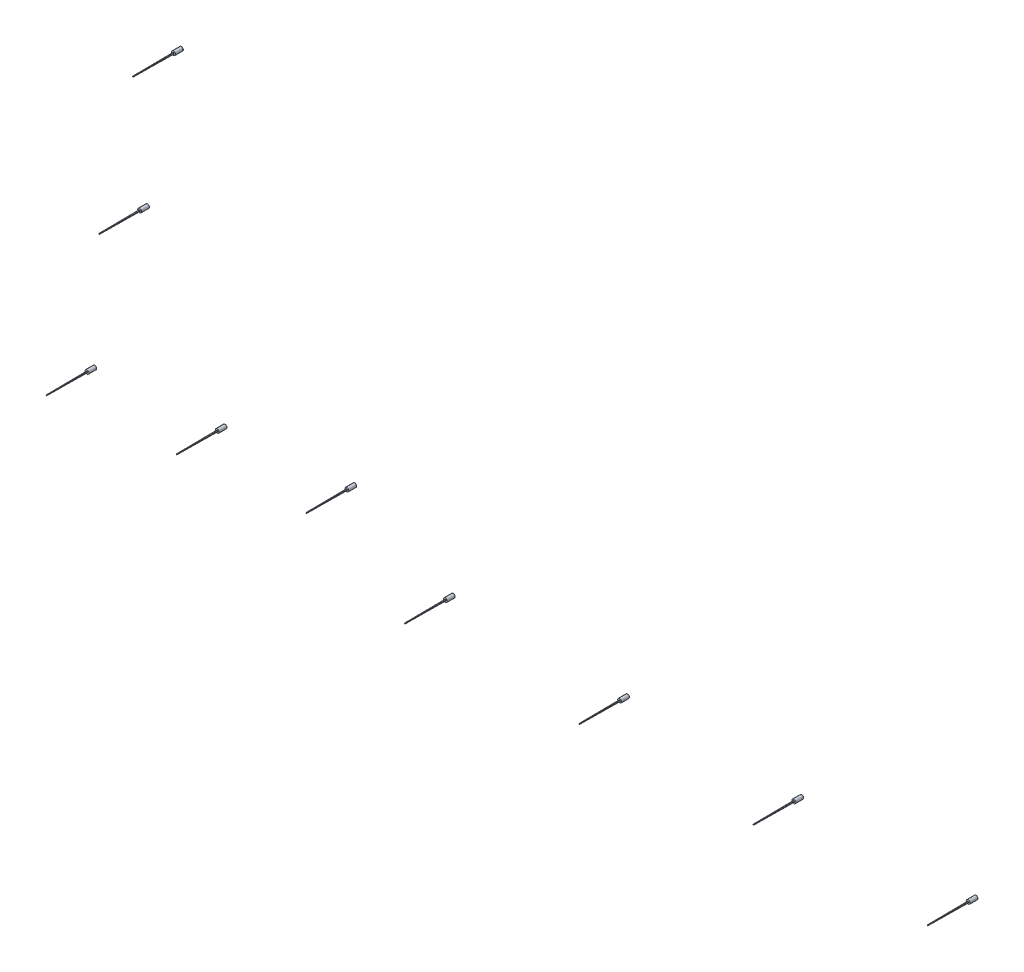
from build123d import *

# Parameters (mm, degrees)
SALIENTE_EXTRUIR1_DEPTH           = 11000
SALIENTE_EXTRUIR1_DRAFT           = 0.39
SALIENTE_EXTRUIR1_PROFILE_2_DEPTH = 11000
SALIENTE_EXTRUIR1_PROFILE_2_DRAFT = 0.39
SALIENTE_EXTRUIR1_PROFILE_3_DEPTH = 11000
SALIENTE_EXTRUIR1_PROFILE_3_DRAFT = 0.39
SALIENTE_EXTRUIR1_PROFILE_4_DEPTH = 11000
SALIENTE_EXTRUIR1_PROFILE_4_DRAFT = 0.39
SALIENTE_EXTRUIR1_PROFILE_5_DEPTH = 11000
SALIENTE_EXTRUIR1_PROFILE_5_DRAFT = 0.39
SALIENTE_EXTRUIR1_PROFILE_6_DEPTH = 11000
SALIENTE_EXTRUIR1_PROFILE_6_DRAFT = 0.39
SALIENTE_EXTRUIR1_PROFILE_7_DEPTH = 11000
SALIENTE_EXTRUIR1_PROFILE_7_DRAFT = 0.39
SALIENTE_EXTRUIR1_PROFILE_8_DEPTH = 11000
SALIENTE_EXTRUIR1_PROFILE_8_DRAFT = 0.39
SALIENTE_EXTRUIR1_PROFILE_9_DEPTH = 11000
SALIENTE_EXTRUIR1_PROFILE_9_DRAFT = 0.39
CROQUIS9_R                        = 450
SALIENTE_EXTRUIR8_DEPTH           = 1700
CROQUIS10_R                       = 455
SALIENTE_EXTRUIR9_DEPTH           = 100
CROQUIS11_R                       = 574.012374022
CORTAR_EXTRUIR1_DEPTH             = 3000
CROQUIS12_R                       = 450
SALIENTE_EXTRUIR10_DEPTH          = 1700
CROQUIS13_R                       = 455
SALIENTE_EXTRUIR11_DEPTH          = 100


with BuildPart() as part:
    # Croquis1 → Saliente-Extruir1 (with draft: the straight prism first)
    with BuildSketch(Plane.XY):
        Polygon((88.617038428, 158.814421575), (-93.228804357, 156.151817274), (-181.845842785, -2.662604301), (-88.617038428, -158.814421575), (93.228804357, -156.151817274), (181.845842785, 2.662604301), align=None)
    extrude(amount=SALIENTE_EXTRUIR1_DEPTH)
    # Saliente-Extruir1: the draft: its side faces are tilted about the plane it starts from
    saliente_extruir1_sides = [part.faces().sort_by_distance(p)[0] for p in [
        (-2.305882965, 157.483119425, 5500),
        (-137.537323571, 76.744606487, 5500),
        (-135.231440607, -80.738512938, 5500),
        (2.305882965, -157.483119425, 5500),
        (137.537323571, -76.744606487, 5500),
        (135.231440607, 80.738512938, 5500),
    ]]
    draft(saliente_extruir1_sides, Plane.XY, SALIENTE_EXTRUIR1_DRAFT)



with BuildPart() as body_2:
    # Croquis1 → Saliente-Extruir1 profile 2 (with draft: the straight prism first)
    with BuildSketch(Plane.XY):
        Polygon((-39933.423158214, 169.241023803), (-40113.278605083, 142.277748192), (-40179.855446869, -26.963275611), (-40066.576841786, -169.241023803), (-39886.721394917, -142.277748192), (-39820.144553131, 26.963275611), align=None)
    extrude(amount=SALIENTE_EXTRUIR1_PROFILE_2_DEPTH)
    # Saliente-Extruir1 profile 2: the draft: its side faces are tilted about the plane it starts from
    saliente_extruir1_profile_2_sides = [body_2.faces().sort_by_distance(p)[0] for p in [
        (-40023.350881648, 155.759385997, 5500),
        (-40146.567025976, 57.65723629, 5500),
        (-40123.216144327, -98.102149707, 5500),
        (-39976.649118352, -155.759385997, 5500),
        (-39853.432974024, -57.65723629, 5500),
        (-39876.783855673, 98.102149707, 5500),
    ]]
    draft(saliente_extruir1_profile_2_sides, Plane.XY, SALIENTE_EXTRUIR1_PROFILE_2_DRAFT)


with BuildPart() as body_3:
    # Croquis1 → Saliente-Extruir1 profile 3 (with draft: the straight prism first)
    with BuildSketch(Plane.XY):
        Polygon((-182312.764922916, 77664.490519876), (-182494.580854337, 77660.251760415), (-182581.817946673, 77500.675165262), (-182487.239107589, 77345.337329569), (-182305.423176169, 77349.576089031), (-182218.186083832, 77509.152684184), align=None)
    extrude(amount=SALIENTE_EXTRUIR1_PROFILE_3_DEPTH)
    # Saliente-Extruir1 profile 3: the draft: its side faces are tilted about the plane it starts from
    saliente_extruir1_profile_3_sides = [body_3.faces().sort_by_distance(p)[0] for p in [
        (-182403.672888627, 77662.371140145, 5500),
        (-182538.199400505, 77580.463462838, 5500),
        (-182534.528527131, 77423.006247416, 5500),
        (-182396.331141879, 77347.4567093, 5500),
        (-182261.80463, 77429.364386607, 5500),
        (-182265.475503374, 77586.82160203, 5500),
    ]]
    draft(saliente_extruir1_profile_3_sides, Plane.XY, SALIENTE_EXTRUIR1_PROFILE_3_DRAFT)

    # Croquis12 → Saliente-Extruir10 (add)
    with BuildSketch(Plane(origin=(0, 0, 0), x_dir=(-1, 0, 0), z_dir=(0, 0, -1))):
        with Locations((182403.672888627, 77506.920712242)):
            Circle(CROQUIS12_R)
    extrude(amount=-SALIENTE_EXTRUIR10_DEPTH)

    # Croquis13 → Saliente-Extruir11 (add)
    with BuildSketch(Plane(origin=(0, 0, 0), x_dir=(-1, 0, 0), z_dir=(0, 0, -1))):
        with Locations((182403.672888627, 77506.920712242)):
            Circle(CROQUIS13_R)
    extrude(amount=SALIENTE_EXTRUIR11_DEPTH)


with BuildPart() as body_4:
    # Croquis1 → Saliente-Extruir1 profile 4 (with draft: the straight prism first)
    with BuildSketch(Plane.XY):
        Polygon((-79908.3116981, 157.061310623), (-80090.174934002, 157.935053987), (-80181.863235901, 0.873743363), (-80091.6883019, -157.061310623), (-79909.825065998, -157.935053987), (-79818.136764099, -0.873743363), align=None)
    extrude(amount=SALIENTE_EXTRUIR1_PROFILE_4_DEPTH)
    # Saliente-Extruir1 profile 4: the draft: its side faces are tilted about the plane it starts from
    saliente_extruir1_profile_4_sides = [body_4.faces().sort_by_distance(p)[0] for p in [
        (-79999.243316051, 157.498182305, 5500),
        (-80136.019084952, 79.404398675, 5500),
        (-80136.775768901, -78.09378363, 5500),
        (-80000.756683949, -157.498182305, 5500),
        (-79863.980915048, -79.404398675, 5500),
        (-79863.224231099, 78.09378363, 5500),
    ]]
    draft(saliente_extruir1_profile_4_sides, Plane.XY, SALIENTE_EXTRUIR1_PROFILE_4_DRAFT)


with BuildPart() as body_5:
    # Croquis1 → Saliente-Extruir1 profile 5 (with draft: the straight prism first)
    with BuildSketch(Plane.XY):
        Polygon((-119896.172838657, 149.314837064), (-120077.396861388, 164.574377857), (-120181.224022731, 15.259540793), (-120103.827161343, -149.314837064), (-119922.603138612, -164.574377858), (-119818.775977269, -15.259540793), align=None)
    extrude(amount=SALIENTE_EXTRUIR1_PROFILE_5_DEPTH)
    # Saliente-Extruir1 profile 5: the draft: its side faces are tilted about the plane it starts from
    saliente_extruir1_profile_5_sides = [body_5.faces().sort_by_distance(p)[0] for p in [
        (-119986.784850023, 156.944607461, 5500),
        (-120129.31044206, 89.916959325, 5500),
        (-120142.525592037, -67.027648136, 5500),
        (-120013.215149977, -156.944607461, 5500),
        (-119870.68955794, -89.916959325, 5500),
        (-119857.474407963, 67.027648135, 5500),
    ]]
    draft(saliente_extruir1_profile_5_sides, Plane.XY, SALIENTE_EXTRUIR1_PROFILE_5_DRAFT)


with BuildPart() as body_6:
    # Croquis1 → Saliente-Extruir1 profile 6 (with draft: the straight prism first)
    with BuildSketch(Plane.XY):
        Polygon((-142531.584159759, 10809.920223672), (-142713.38191326, 10804.962722093), (-142799.987467705, 10645.042498421), (-142704.795268648, 10490.079776328), (-142522.997515147, 10495.037277906), (-142436.391960702, 10654.957501579), align=None)
    extrude(amount=SALIENTE_EXTRUIR1_PROFILE_6_DEPTH)
    # Saliente-Extruir1 profile 6: the draft: its side faces are tilted about the plane it starts from
    saliente_extruir1_profile_6_sides = [body_6.faces().sort_by_distance(p)[0] for p in [
        (-142622.48303651, 10807.441472883, 5500),
        (-142756.684690483, 10725.002610257, 5500),
        (-142752.391368176, 10567.561137374, 5500),
        (-142613.896391897, 10492.558527117, 5500),
        (-142479.694737925, 10574.997389742, 5500),
        (-142483.988060231, 10732.438862625, 5500),
    ]]
    draft(saliente_extruir1_profile_6_sides, Plane.XY, SALIENTE_EXTRUIR1_PROFILE_6_DRAFT)


with BuildPart() as body_7:
    # Croquis1 → Saliente-Extruir1 profile 7 (with draft: the straight prism first)
    with BuildSketch(Plane.XY):
        Polygon((-190012.71485084, 42422.370948195), (-190164.71350507, 42522.22789143), (-190327.191481771, 42440.521667144), (-190337.670804241, 42258.958499622), (-190185.672150011, 42159.101556387), (-190023.194173311, 42240.807780673), align=None)
    extrude(amount=SALIENTE_EXTRUIR1_PROFILE_7_DEPTH)
    # Saliente-Extruir1 profile 7: the draft: its side faces are tilted about the plane it starts from
    saliente_extruir1_profile_7_sides = [body_7.faces().sort_by_distance(p)[0] for p in [
        (-190088.714177955, 42472.299419813, 5500),
        (-190245.95249342, 42481.374779287, 5500),
        (-190332.431143006, 42349.740083383, 5500),
        (-190261.671477126, 42209.030028004, 5500),
        (-190104.433161661, 42199.95466853, 5500),
        (-190017.954512075, 42331.589364434, 5500),
    ]]
    draft(saliente_extruir1_profile_7_sides, Plane.XY, SALIENTE_EXTRUIR1_PROFILE_7_DRAFT)


with BuildPart() as body_8:
    # Croquis1 → Saliente-Extruir1 profile 8 (with draft: the straight prism first)
    with BuildSketch(Plane.XY):
        Polygon((-172211.618628127, 7341.468309254), (-172202.04053876, 7523.081249884), (-172354.532914317, 7622.18258891), (-172516.603379242, 7539.670987307), (-172526.181468609, 7358.058046678), (-172373.689093052, 7258.956707652), align=None)
    extrude(amount=SALIENTE_EXTRUIR1_PROFILE_8_DEPTH)
    # Saliente-Extruir1 profile 8: the draft: its side faces are tilted about the plane it starts from
    saliente_extruir1_profile_8_sides = [body_8.faces().sort_by_distance(p)[0] for p in [
        (-172206.829583443, 7432.274779569, 5500),
        (-172278.286726538, 7572.631919397, 5500),
        (-172435.568146779, 7580.926788109, 5500),
        (-172521.392423925, 7448.864516993, 5500),
        (-172449.93528083, 7308.507377165, 5500),
        (-172292.653860589, 7300.212508453, 5500),
    ]]
    draft(saliente_extruir1_profile_8_sides, Plane.XY, SALIENTE_EXTRUIR1_PROFILE_8_DRAFT)


with BuildPart() as body_9:
    # Croquis1 → Saliente-Extruir1 profile 9 (with draft: the straight prism first)
    with BuildSketch(Plane.XY):
        Polygon((-202157.330322157, 4354.849547188), (-202336.918351888, 4383.539956337), (-202451.558989922, 4242.357364948), (-202386.611598224, 4072.484364411), (-202207.023568493, 4043.793955261), (-202092.38293046, 4184.97654665), align=None)
    extrude(amount=SALIENTE_EXTRUIR1_PROFILE_9_DEPTH)
    # Saliente-Extruir1 profile 9: the draft: its side faces are tilted about the plane it starts from
    saliente_extruir1_profile_9_sides = [body_9.faces().sort_by_distance(p)[0] for p in [
        (-202247.124337023, 4369.194751762, 5500),
        (-202394.238670905, 4312.948660642, 5500),
        (-202419.085294073, 4157.420864679, 5500),
        (-202296.817583359, 4058.139159836, 5500),
        (-202149.703249477, 4114.385250956, 5500),
        (-202124.856626308, 4269.913046919, 5500),
    ]]
    draft(saliente_extruir1_profile_9_sides, Plane.XY, SALIENTE_EXTRUIR1_PROFILE_9_DRAFT)


with BuildPart() as part_1:
    add(part.part)

    add(body_2.part)  # Saliente-Extruir8 merges body 2

    add(body_4.part)  # Saliente-Extruir8 merges body 4

    add(body_5.part)  # Saliente-Extruir8 merges body 5

    add(body_6.part)  # Saliente-Extruir8 merges body 6

    add(body_7.part)  # Saliente-Extruir8 merges body 7

    add(body_8.part)  # Saliente-Extruir8 merges body 8

    add(body_9.part)  # Saliente-Extruir8 merges body 9
    # Croquis9 → Saliente-Extruir8 (add)
    with BuildSketch(Plane(origin=(0, 0, 0), x_dir=(-1, 0, 0), z_dir=(0, 0, -1))):
        Circle(CROQUIS9_R)
        with Locations((40000, 0)):
            Circle(CROQUIS9_R)
        with Locations((80000, 0)):
            Circle(CROQUIS9_R)
        with Locations((120000, 0)):
            Circle(CROQUIS9_R)
        with Locations((142622.48303651, 10652.325069026)):
            Circle(CROQUIS9_R)
        with Locations((172364.111003684, 7440.569648281)):
            Circle(CROQUIS9_R)
        with Locations((202271.970960191, 4213.666955799)):
            Circle(CROQUIS9_R)
        with Locations((190175.192827541, 42340.664723909)):
            Circle(CROQUIS9_R)
        with Locations((185900.002015253, 77404.913924723)):
            Circle(CROQUIS9_R)
    extrude(amount=-SALIENTE_EXTRUIR8_DEPTH)

    # Croquis10 → Saliente-Extruir9 (add)
    with BuildSketch(Plane(origin=(0, 0, 0), x_dir=(-1, 0, 0), z_dir=(0, 0, -1))):
        Circle(CROQUIS10_R)
        with Locations((40000, 0)):
            Circle(CROQUIS10_R)
        with Locations((80000, 0)):
            Circle(CROQUIS10_R)
        with Locations((120000, 0)):
            Circle(CROQUIS10_R)
        with Locations((142622.48303651, 10652.325069026)):
            Circle(CROQUIS10_R)
        with Locations((172364.111003684, 7440.569648281)):
            Circle(CROQUIS10_R)
        with Locations((202271.970960191, 4213.666955799)):
            Circle(CROQUIS10_R)
        with Locations((190175.192827541, 42340.664723909)):
            Circle(CROQUIS10_R)
        with Locations((185900.002015253, 77404.913924723)):
            Circle(CROQUIS10_R)
    extrude(amount=SALIENTE_EXTRUIR9_DEPTH)

    # Croquis11 → Cortar-Extruir1 (cut)
    with BuildSketch(Plane.XY.offset(1700)):
        with Locations((-185902.963496918, 77444.135338977)):
            Circle(CROQUIS11_R)
    extrude(amount=-CORTAR_EXTRUIR1_DEPTH, mode=Mode.SUBTRACT)


solid = Compound([body_3.part, part_1.part])
